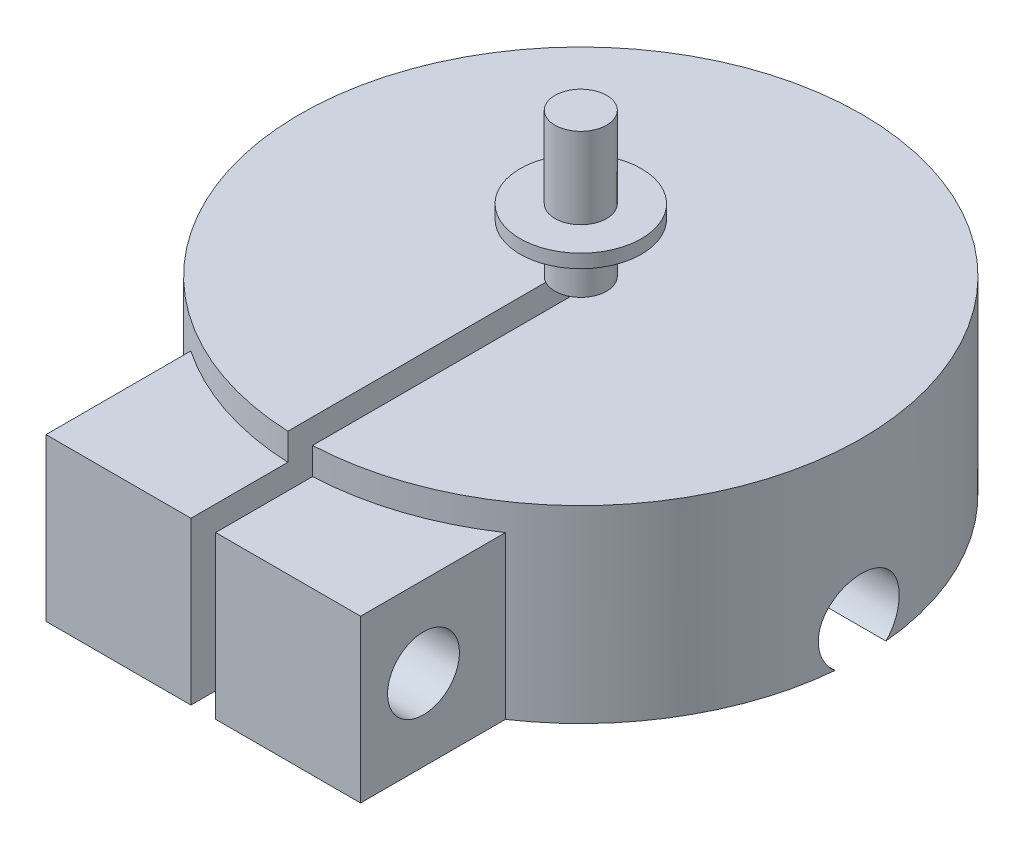
from build123d import *

# Parameters (mm, degrees)
MAIN_PROFILE_SKETCH_R          = 1.15
MAIN_EXTRUSION_DEPTH           = 3.6
DETAIL_PROFILE_2_SKETCH_R      = 2.7
DETAIL_EXTRUSION_2_DEPTH       = 0.6
DETAIL_PROFILE_3_SKETCH_R      = 1.15
DETAIL_EXTRUSION_3_DEPTH       = 2.2
DETAIL_EXTRUSION_4_DEPTH       = 1.2
DETAIL_EXTRUSION_5_DEPTH       = 2.8
DETAIL_EXTRUSION_6_DEPTH       = 4.4
ADAPTER_CROSS_BORE_1_PROFILE_R = 1.8
ADAPTER_CROSS_BORE_1_DEPTH     = 28
ADAPTER_CROSS_BORE_2_PROFILE_R = 1.6
ADAPTER_CROSS_BORE_2_DEPTH     = 16


with BuildPart() as part:
    # Main Profile Sketch → Main Extrusion (new body)
    with BuildSketch(Plane(origin=(0, -199.6, 0), x_dir=(-1, 0, 0), z_dir=(0, -1, 0))):
        with Locations(Location((19.009182883, 53.244882879, 0), (0, 0, 90))):
            Circle(MAIN_PROFILE_SKETCH_R)
    extrude(amount=MAIN_EXTRUSION_DEPTH)

    # Detail Profile 2 Sketch → Detail Extrusion 2 (add)
    with BuildSketch(Plane(origin=(0, -203.2, 0), x_dir=(-1, 0, 0), z_dir=(0, -1, 0))):
        with Locations(Location((19.009182883, 53.244882879, 0), (0, 0, 90))):
            Circle(DETAIL_PROFILE_2_SKETCH_R)
    extrude(amount=DETAIL_EXTRUSION_2_DEPTH)

    # Detail Profile 3 Sketch → Detail Extrusion 3 (add)
    with BuildSketch(Plane(origin=(0, -203.8, 0), x_dir=(-1, 0, 0), z_dir=(0, -1, 0))):
        with Locations(Location((19.009182883, 53.244882879, 0), (0, 0, 90))):
            Circle(DETAIL_PROFILE_3_SKETCH_R)
    extrude(amount=DETAIL_EXTRUSION_3_DEPTH)

    # Detail Profile 4 Sketch → Detail Extrusion 4 (add)
    with BuildSketch(Plane(origin=(0, -206, 0), x_dir=(-1, 0, 0), z_dir=(0, -1, 0))):
        with BuildLine():
            Line((18.459182883, 53.244882879), (18.459182883, 40.756988741))
            ThreePointArc((18.459182883, 40.756988741), (19.009182883, 65.744882879), (19.559182883, 40.756988741))
            Line((19.559182883, 40.756988741), (19.559182883, 53.244882879))
            Line((19.559182883, 53.244882879), (18.459182883, 53.244882879))
        make_face()
    extrude(amount=DETAIL_EXTRUSION_4_DEPTH)

    # Detail Profile 5 Sketch → Detail Extrusion 5 (add)
    with BuildSketch(Plane(origin=(0, -207.2, 0), x_dir=(-1, 0, 0), z_dir=(0, -1, 0))):
        with BuildLine():
            Line((12.009182883, 42.88872529), (12.009182883, 36.444882879))
            Line((12.009182883, 36.444882879), (18.459182883, 36.444882879))
            Line((18.459182883, 36.444882879), (18.459182883, 53.244882879))
            Line((18.459182883, 53.244882879), (19.559182883, 53.244882879))
            Line((19.559182883, 53.244882879), (19.559182883, 36.444882879))
            Line((19.559182883, 36.444882879), (26.009182883, 36.444882879))
            Line((26.009182883, 36.444882879), (26.009182883, 42.88872529))
            ThreePointArc((26.009182883, 42.88872529), (19.009182883, 65.744882879), (12.009182883, 42.88872529))
        make_face()
    extrude(amount=DETAIL_EXTRUSION_5_DEPTH)

    # Detail Profile 6 Sketch → Detail Extrusion 6 (add)
    with BuildSketch(Plane(origin=(0, -210, 0), x_dir=(-1, 0, 0), z_dir=(0, -1, 0))):
        with BuildLine():
            Line((12.009182883, 42.88872529), (12.009182883, 36.444882879))
            Line((12.009182883, 36.444882879), (18.459182883, 36.444882879))
            Line((18.459182883, 36.444882879), (18.459182883, 44.261704154))
            ThreePointArc((18.459182883, 44.261704154), (19.009182883, 62.244882879), (19.559182883, 44.261704154))
            Line((19.559182883, 44.261704154), (19.559182883, 36.444882879))
            Line((19.559182883, 36.444882879), (26.009182883, 36.444882879))
            Line((26.009182883, 36.444882879), (26.009182883, 42.88872529))
            ThreePointArc((26.009182883, 42.88872529), (19.009182883, 65.744882879), (12.009182883, 42.88872529))
        make_face()
    extrude(amount=DETAIL_EXTRUSION_6_DEPTH)

    # Adapter Cross Bore 1 profile → Adapter Cross Bore 1 (cut)
    with BuildSketch(Plane(origin=(-33.009182883, 0, 0), x_dir=(0, 0, -1), z_dir=(1, 0, 0))):
        with Locations((53.244882879, -213)):
            Circle(ADAPTER_CROSS_BORE_1_PROFILE_R)
    extrude(amount=ADAPTER_CROSS_BORE_1_DEPTH, mode=Mode.SUBTRACT)

    # Adapter Cross Bore 2 profile → Adapter Cross Bore 2 (cut)
    with BuildSketch(Plane(origin=(-27.009182883, 0, 0), x_dir=(0, 0, -1), z_dir=(1, 0, 0))):
        with Locations(Location((39.244882879, -210.8, 0), (0, 0, 180))):
            Circle(ADAPTER_CROSS_BORE_2_PROFILE_R)
    extrude(amount=ADAPTER_CROSS_BORE_2_DEPTH, mode=Mode.SUBTRACT)


solid = part.part
